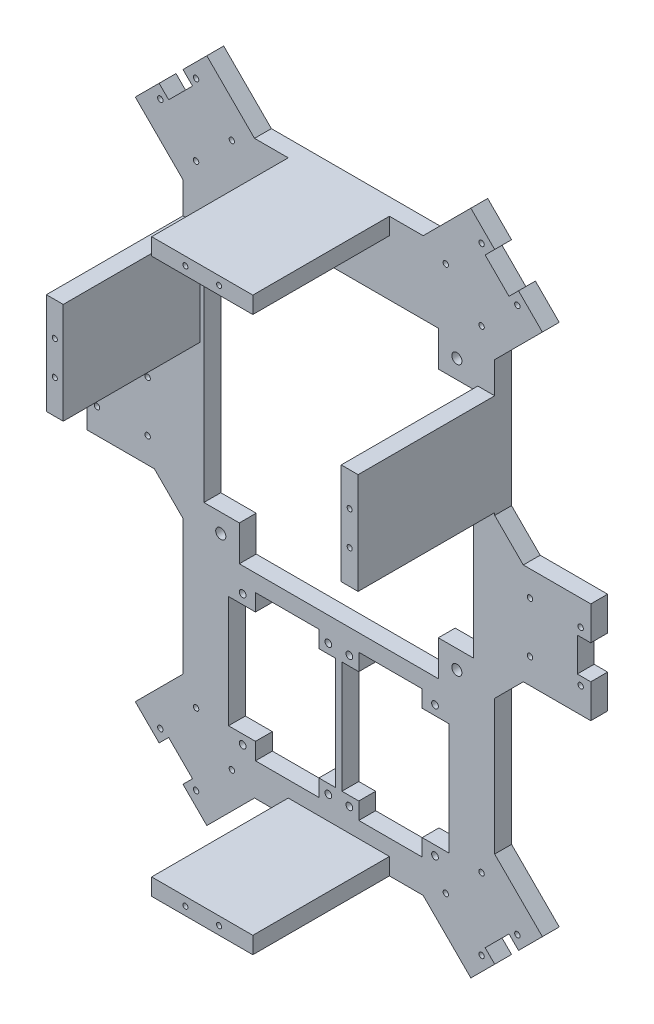
from build123d import *

# Parameters (mm, degrees)
DODANIE_WYCI_GNI_CIE1_DEPTH     = 5
WYTNIJ_WYCI_GNI_CIE3_DEPTH      = 16
WYTNIJ_WYCI_GNI_CIE3_DEPTH_BACK = 4
SZKIC3_R                        = 0.8
WYTNIJ_WYCI_GNI_CIE4_DEPTH      = 26
WYTNIJ_WYCI_GNI_CIE4_DEPTH_BACK = 52
SZKIC5_R                        = 1.5
WYTNIJ_WYCI_GNI_CIE5_DEPTH      = 31
WYTNIJ_WYCI_GNI_CIE5_DEPTH_BACK = 69
WYTNIJ_WYCI_GNI_CIE6_DEPTH      = 22
WYTNIJ_WYCI_GNI_CIE6_DEPTH_BACK = 83
SZKIC7_R                        = 1
SZKIC8_W                        = 30
SZKIC8_H                        = 5
DODANIE_WYCI_GNI_CIE2_DEPTH     = 45.5
SZKIC10_W                       = 30
SZKIC10_H                       = 5
DODANIE_WYCI_GNI_CIE3_DEPTH     = 40.5
WYTNIJ_WYCI_GNI_CIE7_DEPTH      = 112
WYTNIJ_WYCI_GNI_CIE7_DEPTH_BACK = 158
SZKIC11_R                       = 0.75
WYTNIJ_WYCI_GNI_CIE8_DEPTH      = 220
WYTNIJ_WYCI_GNI_CIE8_DEPTH_BACK = 402
SZKIC12_R                       = 0.75
SZKIC13_W                       = 5
SZKIC13_H                       = 30
DODANIE_WYCI_GNI_CIE4_DEPTH     = 40.5
WYTNIJ_WYCI_GNI_CIE9_DEPTH      = 48
WYTNIJ_WYCI_GNI_CIE9_DEPTH_BACK = 85
SZKIC14_R                       = 0.75


with BuildPart() as part:
    # Szkic1 → Dodanie-wyciągnięcie1 (new body)
    with BuildSketch(Plane.XY):
        Polygon((0, 0), (-50, 0), (-64.142135624, 14.142135624), (-71.213203436, 7.071067812), (-68.384776311, 4.242640687), (-75.455844123, -2.828427125), (-78.284271247, 0), (-85.355339059, -7.071067812), (-71.213203436, -21.213203436), (-71.213203436, -61.213203436), (-79.69848481, -69.69848481), (-99.69848481, -69.69848481), (-99.69848481, -79.69848481), (-95.69848481, -79.69848481), (-95.69848481, -89.69848481), (-99.69848481, -89.69848481), (-99.69848481, -99.69848481), (-79.69848481, -99.69848481), (-71.213203436, -108.183766184), (-71.213203436, -148.183766184), (-85.355339059, -162.325901808), (-78.284271247, -169.39696962), (-75.455844123, -166.568542495), (-68.384776311, -173.639610307), (-71.213203436, -176.468037432), (-64.142135624, -183.539105243), (-50, -169.39696962), (0, -169.39696962), (14.142135624, -183.539105243), (21.213203436, -176.468037432), (18.384776311, -173.639610307), (25.455844123, -166.568542495), (28.284271247, -169.39696962), (35.355339059, -162.325901808), (21.213203436, -148.183766184), (21.213203436, -108.183766184), (29.69848481, -99.69848481), (49.69848481, -99.69848481), (49.69848481, -89.69848481), (45.69848481, -89.69848481), (45.69848481, -79.69848481), (49.69848481, -79.69848481), (49.69848481, -69.69848481), (29.69848481, -69.69848481), (21.213203436, -61.213203436), (21.213203436, -21.213203436), (35.355339059, -7.071067812), (28.284271247, 0), (25.455844123, -2.828427125), (18.384776311, 4.242640687), (21.213203436, 7.071067812), (14.142135624, 14.142135624), align=None)
    extrude(amount=DODANIE_WYCI_GNI_CIE1_DEPTH)

    # Szkic3 → Wytnij-wyciągnięcie3 (cut, two sides: drawn at the far end of the back side and taken through both)
    with BuildSketch(Plane.XY.offset(-WYTNIJ_WYCI_GNI_CIE3_DEPTH_BACK)):
        with Locations((31.69848481, -77.19848481)):
            Circle(SZKIC3_R)
        with Locations((46.69848481, -77.19848481)):
            Circle(SZKIC3_R)
        with Locations((31.69848481, -92.19848481)):
            Circle(SZKIC3_R)
        with Locations((46.69848481, -92.19848481)):
            Circle(SZKIC3_R)
        with Locations((-81.69848481, -77.19848481)):
            Circle(SZKIC3_R)
        with Locations((-96.69848481, -77.19848481)):
            Circle(SZKIC3_R)
        with Locations((17.324116139, -154.901280605)):
            Circle(SZKIC3_R)
        with Locations((27.930717857, -165.507882323)):
            Circle(SZKIC3_R)
        with Locations((17.324116139, -176.114484041)):
            Circle(SZKIC3_R)
        with Locations((6.717514421, -165.507882323)):
            Circle(SZKIC3_R)
        with Locations((-67.324116139, -154.901280605)):
            Circle(SZKIC3_R)
        with Locations((-77.930717857, -165.507882323)):
            Circle(SZKIC3_R)
        with Locations((-67.324116139, -176.114484041)):
            Circle(SZKIC3_R)
        with Locations((-56.717514421, -165.507882323)):
            Circle(SZKIC3_R)
        with Locations((17.324116139, 6.717514421)):
            Circle(SZKIC3_R)
        with Locations((27.930717857, -3.889087297)):
            Circle(SZKIC3_R)
        with Locations((6.717514421, -3.889087297)):
            Circle(SZKIC3_R)
        with Locations((17.324116139, -14.495689014)):
            Circle(SZKIC3_R)
        with Locations((-67.324116139, 6.717514421)):
            Circle(SZKIC3_R)
        with Locations((-56.717514421, -3.889087297)):
            Circle(SZKIC3_R)
        with Locations((-77.930717857, -3.889087297)):
            Circle(SZKIC3_R)
        with Locations((-67.324116139, -14.495689014)):
            Circle(SZKIC3_R)
        with Locations((-96.69848481, -92.19848481)):
            Circle(SZKIC3_R)
        with Locations((-81.69848481, -92.19848481)):
            Circle(SZKIC3_R)
    extrude(amount=WYTNIJ_WYCI_GNI_CIE3_DEPTH + WYTNIJ_WYCI_GNI_CIE3_DEPTH_BACK, mode=Mode.SUBTRACT)

    # Szkic5 → Wytnij-wyciągnięcie4 (cut, two sides: drawn at the far end of the back side and taken through both)
    with BuildSketch(Plane.XY.offset(-WYTNIJ_WYCI_GNI_CIE4_DEPTH_BACK)):
        with Locations((-60.003203436, -26.5)):
            Circle(SZKIC5_R)
        with Locations((9.996796564, -26.5)):
            Circle(SZKIC5_R)
        with Locations((9.996796564, -106.5)):
            Circle(SZKIC5_R)
        with Locations((-60.003203436, -106.5)):
            Circle(SZKIC5_R)
        Polygon((4.496796564, -21.5), (-54.503203436, -21.5), (-54.503203436, -32), (-65.003203436, -32), (-65.003203436, -101), (-54.503203436, -101), (-54.503203436, -111.5), (4.496796564, -111.5), (4.496796564, -101), (14.996796564, -101), (14.996796564, -32), (4.496796564, -32), align=None)
    extrude(amount=WYTNIJ_WYCI_GNI_CIE4_DEPTH + WYTNIJ_WYCI_GNI_CIE4_DEPTH_BACK, mode=Mode.SUBTRACT)

    # Szkic6 → Wytnij-wyciągnięcie5 (cut, two sides: drawn at the far end of the back side and taken through both)
    with BuildSketch(Plane.XY.offset(5).offset(-WYTNIJ_WYCI_GNI_CIE5_DEPTH_BACK)):
        Polygon((-30.913203436, -116.49696962), (-49.713203436, -116.49696962), (-49.713203436, -121.49696962), (-57.713203436, -121.49696962), (-57.713203436, -154.69696962), (-49.713203436, -154.69696962), (-49.713203436, -159.69696962), (-30.913203436, -159.69696962), (-30.913203436, -154.69696962), (-25.913203436, -154.69696962), (-25.913203436, -121.49696962), (-30.913203436, -121.49696962), align=None)
        Polygon((-0.286796564, -121.49696962), (-0.286796564, -116.49696962), (-19.086796564, -116.49696962), (-19.086796564, -121.49696962), (-24.086796564, -121.49696962), (-24.086796564, -154.69696962), (-19.086796564, -154.69696962), (-19.086796564, -159.69696962), (-0.286796564, -159.69696962), (-0.286796564, -154.69696962), (7.713203436, -154.69696962), (7.713203436, -121.49696962), align=None)
    extrude(amount=WYTNIJ_WYCI_GNI_CIE5_DEPTH + WYTNIJ_WYCI_GNI_CIE5_DEPTH_BACK, mode=Mode.SUBTRACT)

    # Szkic7 → Wytnij-wyciągnięcie6 (cut, two sides: drawn at the far end of the back side and taken through both)
    with BuildSketch(Plane.XY.offset(5).offset(-WYTNIJ_WYCI_GNI_CIE6_DEPTH_BACK)):
        with Locations((-53.513203436, -118.69696962)):
            Circle(SZKIC7_R)
        with Locations((-28.113203436, -118.69696962)):
            Circle(SZKIC7_R)
        with Locations((-21.886796564, -118.69696962)):
            Circle(SZKIC7_R)
        with Locations((3.513203436, -118.69696962)):
            Circle(SZKIC7_R)
        with Locations((3.513203436, -157.49696962)):
            Circle(SZKIC7_R)
        with Locations((-21.886796564, -157.49696962)):
            Circle(SZKIC7_R)
        with Locations((-28.113203436, -157.49696962)):
            Circle(SZKIC7_R)
        with Locations((-53.513203436, -157.49696962)):
            Circle(SZKIC7_R)
    extrude(amount=WYTNIJ_WYCI_GNI_CIE6_DEPTH + WYTNIJ_WYCI_GNI_CIE6_DEPTH_BACK, mode=Mode.SUBTRACT)

    # Szkic8 → Dodanie-wyciągnięcie2 (add)
    with BuildSketch(Plane.XY):
        with Locations((-25, -2.5)):
            Rectangle(SZKIC8_W, SZKIC8_H)
    extrude(amount=DODANIE_WYCI_GNI_CIE2_DEPTH)

    # Szkic10 → Dodanie-wyciągnięcie3 (add)
    with BuildSketch(Plane.XY.offset(5)):
        with Locations((-25, -166.89696962)):
            Rectangle(SZKIC10_W, SZKIC10_H)
    extrude(amount=DODANIE_WYCI_GNI_CIE3_DEPTH)

    # Szkic11 → Wytnij-wyciągnięcie7 (cut, two sides: drawn at the far end of the back side and taken through both)
    with BuildSketch(Plane.XY.offset(45.5).offset(-WYTNIJ_WYCI_GNI_CIE7_DEPTH_BACK)):
        with Locations((-30, -2.5)):
            Circle(SZKIC11_R)
        with Locations((-20, -2.5)):
            Circle(SZKIC11_R)
    extrude(amount=WYTNIJ_WYCI_GNI_CIE7_DEPTH + WYTNIJ_WYCI_GNI_CIE7_DEPTH_BACK, mode=Mode.SUBTRACT)

    # Szkic12 → Wytnij-wyciągnięcie8 (cut, two sides: drawn at the far end of the back side and taken through both)
    with BuildSketch(Plane.XY.offset(45.5).offset(-WYTNIJ_WYCI_GNI_CIE8_DEPTH_BACK)):
        with Locations(Location((-30, -166.89696962, 0), (0, 0, 180))):
            Circle(SZKIC12_R)
        with Locations(Location((-20, -166.89696962, 0), (0, 0, 180))):
            Circle(SZKIC12_R)
    extrude(amount=WYTNIJ_WYCI_GNI_CIE8_DEPTH + WYTNIJ_WYCI_GNI_CIE8_DEPTH_BACK, mode=Mode.SUBTRACT)

    # Szkic13 → Dodanie-wyciągnięcie4 (add)
    with BuildSketch(Plane.XY.offset(5)):
        with Locations((-68.713203436, -45.5)):
            Rectangle(SZKIC13_W, SZKIC13_H)
        with Locations((18.713203436, -45.5)):
            Rectangle(SZKIC13_W, SZKIC13_H)
    extrude(amount=DODANIE_WYCI_GNI_CIE4_DEPTH)

    # Szkic14 → Wytnij-wyciągnięcie9 (cut, two sides: drawn at the far end of the back side and taken through both)
    with BuildSketch(Plane.XY.offset(-WYTNIJ_WYCI_GNI_CIE9_DEPTH_BACK)):
        with Locations(Location((-68.713203436, -40.5, 0), (0, 0, 180))):
            Circle(SZKIC14_R)
        with Locations(Location((-68.713203436, -50.5, 0), (0, 0, 180))):
            Circle(SZKIC14_R)
        with Locations((18.713203436, -40.5)):
            Circle(SZKIC14_R)
        with Locations((18.713203436, -50.5)):
            Circle(SZKIC14_R)
    extrude(amount=WYTNIJ_WYCI_GNI_CIE9_DEPTH + WYTNIJ_WYCI_GNI_CIE9_DEPTH_BACK, mode=Mode.SUBTRACT)


solid = part.part
